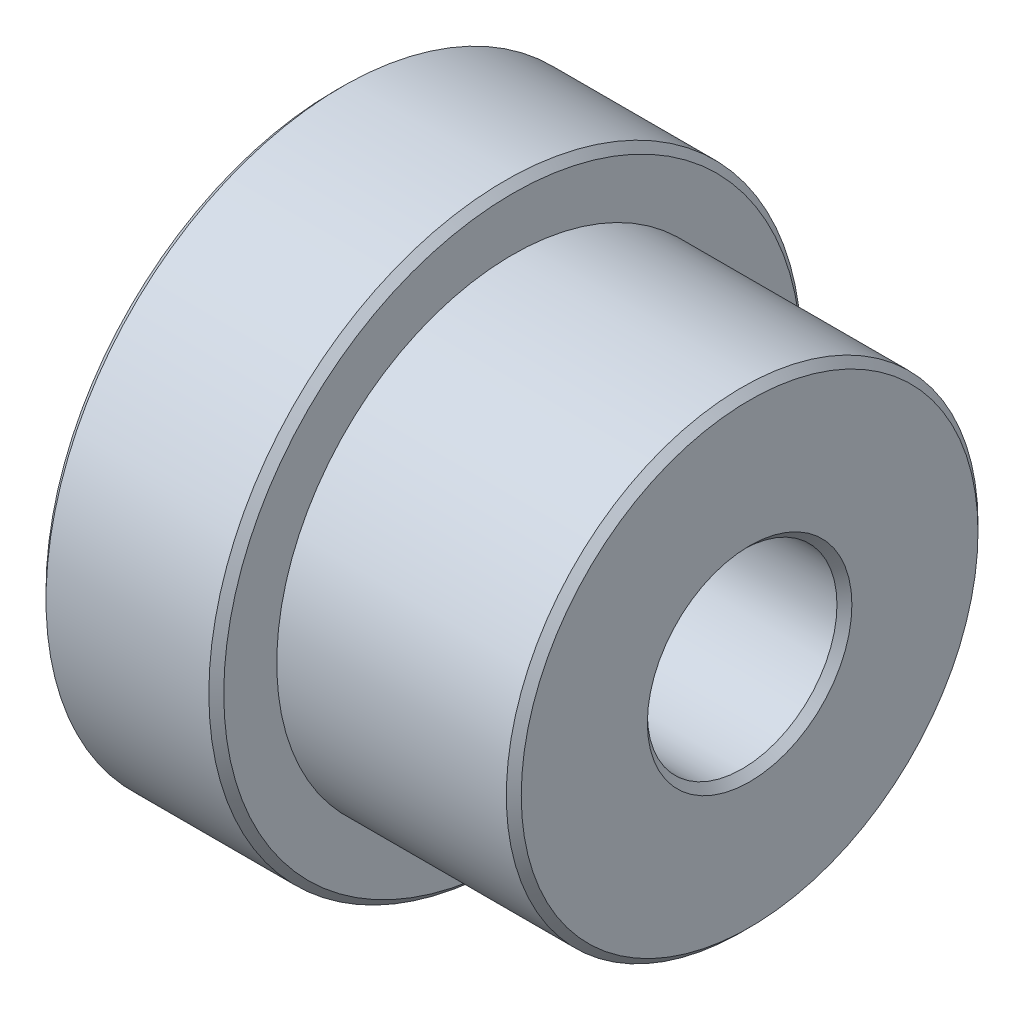
from build123d import *

# Parameters (mm, degrees)
SKETCH1_R           = 12.6365
BOSS_EXTRUDE1_DEPTH = 12.7
SKETCH2_R           = 15.875
BOSS_EXTRUDE2_DEPTH = 9.525
SKETCH3_R           = 11.1125
CUT_EXTRUDE1_DEPTH  = 7.112
SKETCH4_R           = 7.27458794
CUT_EXTRUDE2_DEPTH  = 0.2
SKETCH5_R           = 5.08
CUT_EXTRUDE3_DEPTH  = 27.952343479
CHAMFER1_SIZE       = 0.4


with BuildPart() as part:
    # Sketch1 → Boss-Extrude1 (new body)
    with BuildSketch(Plane(origin=(0, 0, 0), x_dir=(0, 0, -1), z_dir=(1, 0, 0))):
        Circle(SKETCH1_R)
    extrude(amount=BOSS_EXTRUDE1_DEPTH)

    # Sketch2 → Boss-Extrude2 (add)
    with BuildSketch(Plane.ZY):
        with Locations(Location((0, 0, 0), (0, 0, 180))):
            Circle(SKETCH2_R)
    extrude(amount=BOSS_EXTRUDE2_DEPTH)

    # Sketch3 → Cut-Extrude1 (cut)
    with BuildSketch(Plane.ZY.offset(9.525)):
        Circle(SKETCH3_R)
    extrude(amount=-CUT_EXTRUDE1_DEPTH, mode=Mode.SUBTRACT)

    # Sketch4 → Cut-Extrude2 (cut)
    with BuildSketch(Plane.ZY.offset(2.413)):
        Circle(SKETCH4_R)
    extrude(amount=-CUT_EXTRUDE2_DEPTH, mode=Mode.SUBTRACT)

    # Sketch5 → Cut-Extrude3 (cut, through all)
    with BuildSketch(Plane.ZY.offset(2.213)):
        Circle(SKETCH5_R)
    extrude(amount=-CUT_EXTRUDE3_DEPTH, mode=Mode.SUBTRACT)

    # Chamfer1
    chamfer1_edges = [part.edges().sort_by_distance(p)[0] for p in [
        (-9.525, 0, -11.1125),
        (12.7, 0, -5.08),
        (12.7, 0, 12.6365),
        (0, 0, 15.875),
        (-9.525, 0, 15.875),
    ]]
    chamfer(chamfer1_edges, length=CHAMFER1_SIZE)


solid = part.part
